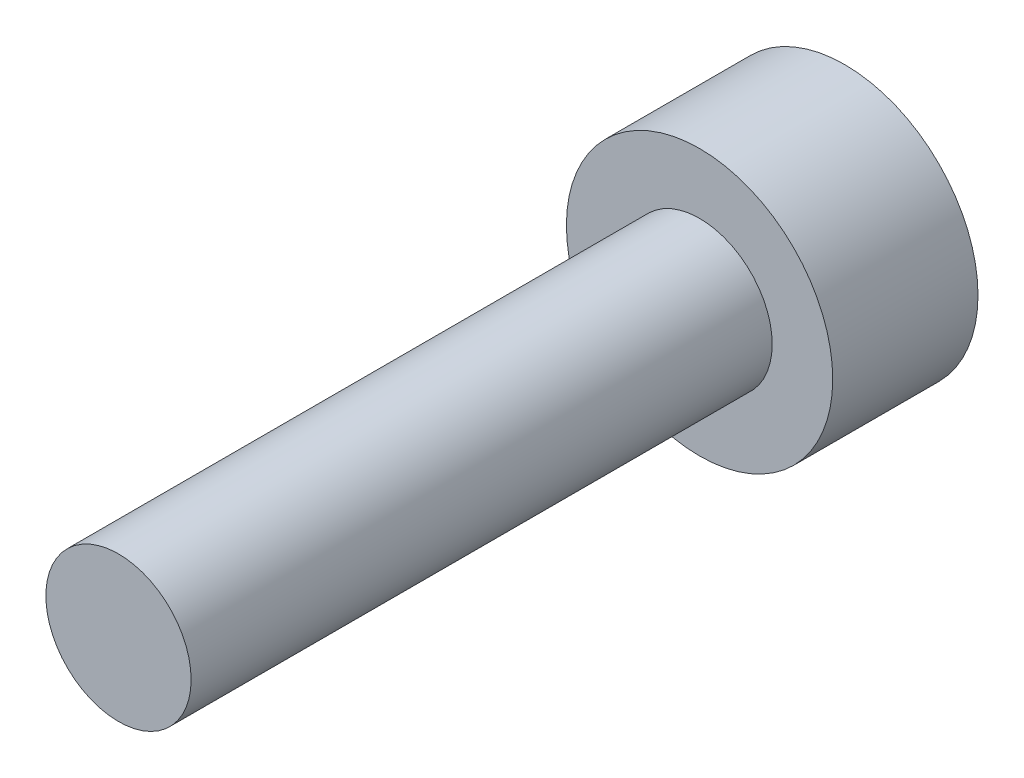
from build123d import *

# Parameters (mm, degrees)
CABEZA_START            = -3
CROQUIS1_R              = 2.75
CABEZA_DEPTH            = 3
CROQUIS2_R              = 1.5
CUERPO_DEPTH            = 12
HEXAGONO_INTERIOR_START = -3
HEXAGONO_INTERIOR_DEPTH = 1.3


with BuildPart() as part:
    # Croquis1 → Cabeza (new body)
    with BuildSketch(Plane.XY.offset(CABEZA_START)):
        Circle(CROQUIS1_R)
    extrude(amount=CABEZA_DEPTH)

    # Croquis2 → Cuerpo (add)
    with BuildSketch(Plane.XY):
        Circle(CROQUIS2_R)
    extrude(amount=CUERPO_DEPTH)

    # Croquis3 → Hexagono_interior (cut)
    with BuildSketch(Plane.XY.offset(HEXAGONO_INTERIOR_START)):
        Polygon((1.443375673, 0), (0.721687836, 1.25), (-0.721687836, 1.25), (-1.443375673, 0), (-0.721687836, -1.25), (0.721687836, -1.25), align=None)
    extrude(amount=HEXAGONO_INTERIOR_DEPTH, mode=Mode.SUBTRACT)


solid = part.part
